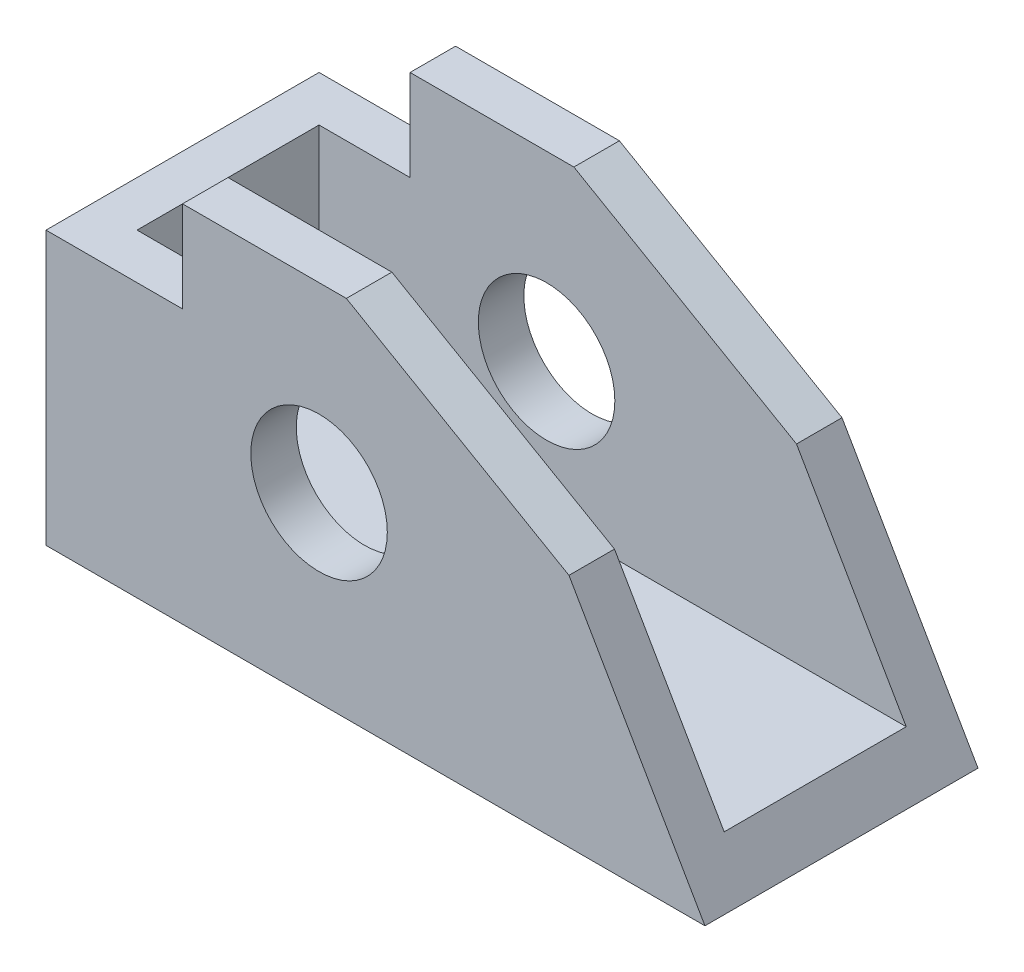
from build123d import *

# Parameters (mm, degrees)
SKETCH1_W           = 91.948
SKETCH1_H           = 38.1
BOSS_EXTRUDE1_DEPTH = 50.8
SKETCH2_R           = 9.525
CUT_EXTRUDE1_DEPTH  = 116.82034416
SKETCH3_W           = 19.05
SKETCH3_H           = 12.7
CUT_EXTRUDE2_DEPTH  = 116.82034416
SKETCH4_W           = 12.7
SKETCH4_H           = 25.4
SKETCH4_W_2         = 72.898
CUT_EXTRUDE5_DEPTH  = 44.45
CUT_EXTRUDE6_DEPTH  = 116.82034416


with BuildPart() as part:
    # Sketch1 → Boss-Extrude1 (new body)
    with BuildSketch(Plane(origin=(0, 0, 0), x_dir=(1, 0, 0), z_dir=(0, 1, 0))):
        with Locations((-50.887251908, 28.561750636)):
            Rectangle(SKETCH1_W, SKETCH1_H)
    extrude(amount=BOSS_EXTRUDE1_DEPTH)

    # Sketch2 → Cut-Extrude1 (cut, through all)
    with BuildSketch(Plane.XY.offset(-9.511750636)):
        with Locations((-58.761251908, 25.4)):
            Circle(SKETCH2_R)
    extrude(amount=-CUT_EXTRUDE1_DEPTH, mode=Mode.SUBTRACT)

    # Sketch3 → Cut-Extrude2 (cut, through all)
    with BuildSketch(Plane.XY.offset(-9.511750636)):
        with Locations((-87.336251908, 44.45)):
            Rectangle(SKETCH3_W, SKETCH3_H)
    extrude(amount=-CUT_EXTRUDE2_DEPTH, mode=Mode.SUBTRACT)

    # Sketch4 → Cut-Extrude5 (cut)
    with BuildSketch(Plane(origin=(0, 50.8, 0), x_dir=(1, 0, 0), z_dir=(0, 1, 0))):
        with Locations((-84.161251908, 28.561750636)):
            Rectangle(SKETCH4_W, SKETCH4_H)
        with Locations((-41.362251908, 28.561750636)):
            Rectangle(SKETCH4_W_2, SKETCH4_H)
    extrude(amount=-CUT_EXTRUDE5_DEPTH, mode=Mode.SUBTRACT)

    # Sketch5 → Cut-Extrude6 (cut, through all)
    with BuildSketch(Plane.XY.offset(-9.511750636)):
        Polygon((-23.888342421, 32.865820845), (-4.913251908, 0), (-4.913251908, 50.8), (-54.951251908, 50.8), align=None)
    extrude(amount=-CUT_EXTRUDE6_DEPTH, mode=Mode.SUBTRACT)


solid = part.part
